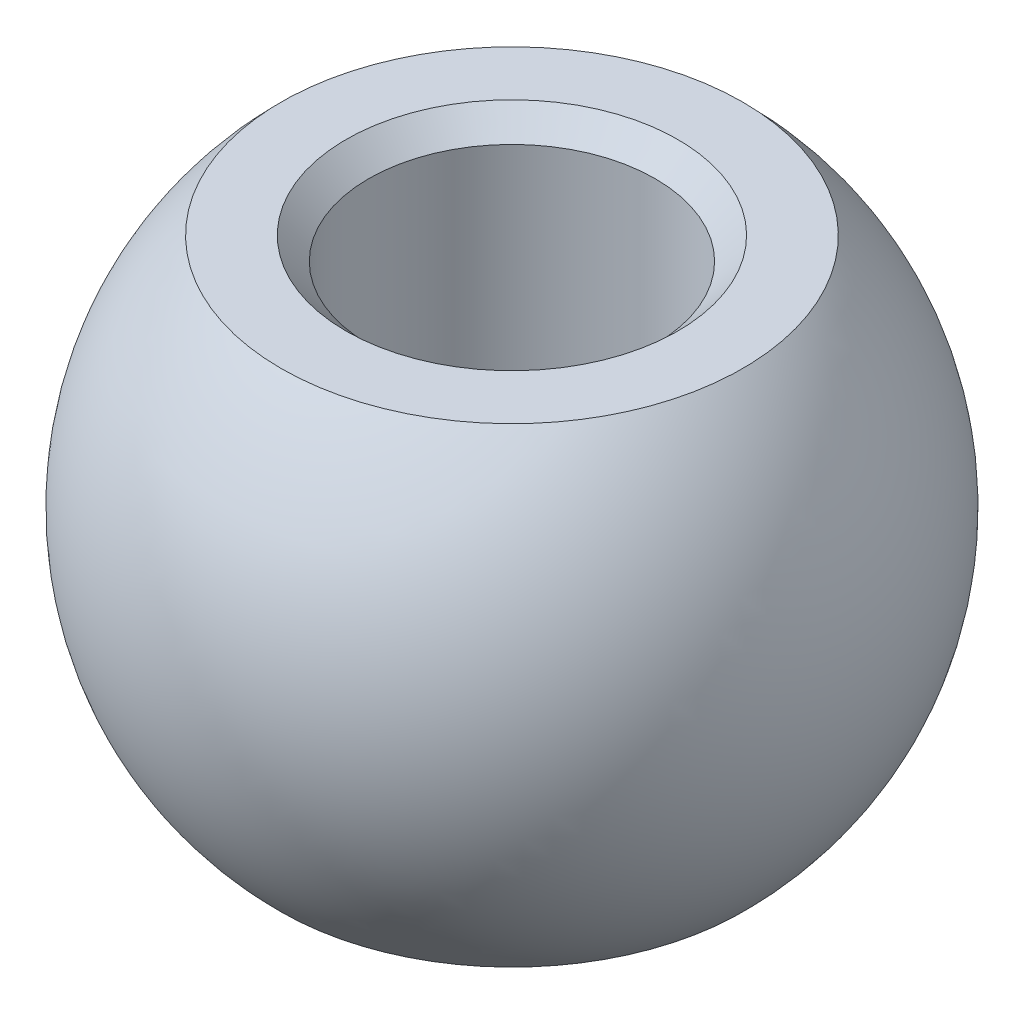
from build123d import *

# Parameters (mm, degrees)
CHAMFER1_SIZE = 0.381


with BuildPart() as part:
    # Sketch1 → Revolve1 (revolve)
    with BuildSketch(Plane.XY, mode=Mode.PRIVATE) as revolve1_sk:
        with BuildLine():
            Line((2.413, 0), (2.413, 7.9248))
            Line((2.413, 7.9248), (3.8862, 7.9248))
            ThreePointArc((3.8862, 7.9248), (5.550128275, 3.9624), (3.8862, 0))
            Line((3.8862, 0), (2.413, 0))
        make_face()
    revolve(revolve1_sk.sketch.rotate(Axis((0, 0, 0), (0, 1, 0)), 90), axis=Axis((0, 0, 0), (0, 1, 0)))

    # Chamfer1
    chamfer1_edges = [part.edges().sort_by_distance(p)[0] for p in [
        (0, 7.9248, 2.413),
        (0, 0, 2.413),
    ]]
    chamfer(chamfer1_edges, length=CHAMFER1_SIZE)


solid = part.part
